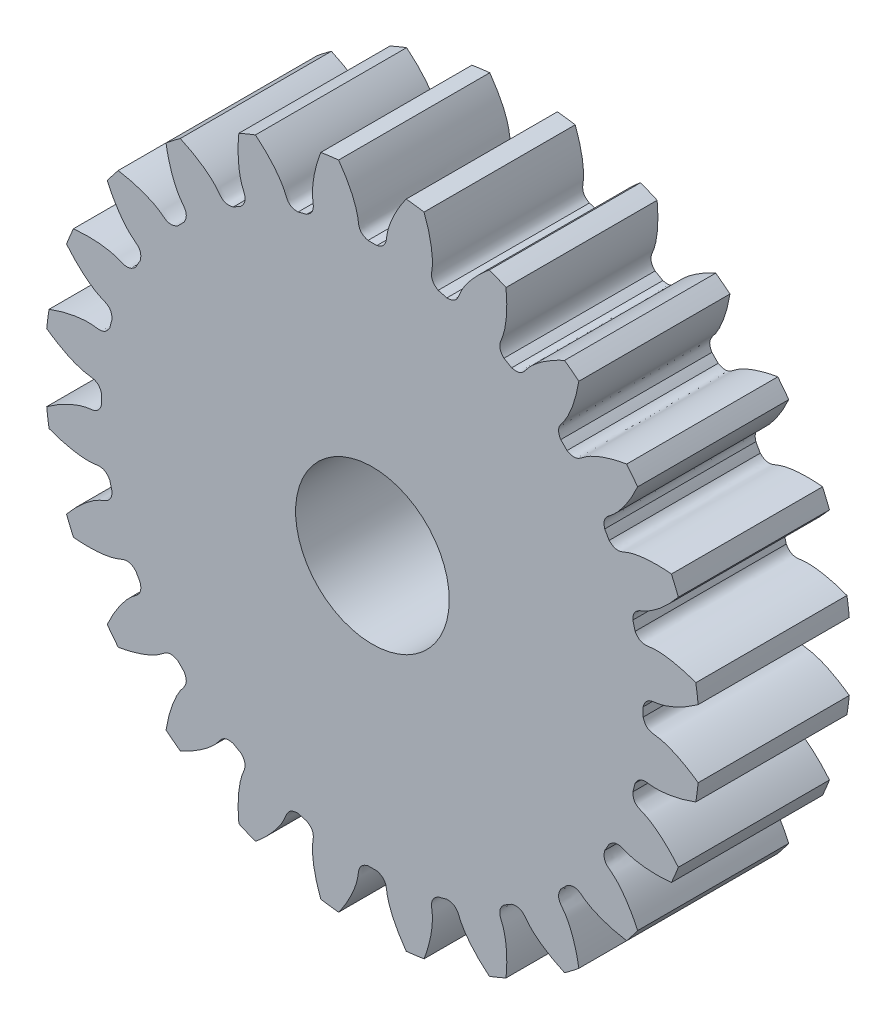
from build123d import *

# Parameters (mm, degrees)
SKETCH_1_R               = 6.5
EXTRUDE_1_DEPTH          = 3
CUT_EXTRUDE_1_DEPTH      = 10.669539803
PATTERN_CIRCULAR_1_COUNT = 24
CUT_EXTRUDE_2_REACH      = 11.623
SKETCH_4_R               = 1.525


with BuildPart() as part:
    # 草图1 → 凸台-拉伸1 (new body)
    with BuildSketch(Plane.XY):
        Circle(SKETCH_1_R)
    extrude(amount=EXTRUDE_1_DEPTH)

    # 草图2 → 切除-拉伸1 (cut, through all)
    with BuildSketch(Plane.XY):
        with BuildLine():
            ThreePointArc((0.088415956, 5.374272753), (0, 5.375), (-0.088415956, 5.374272753))
            add(Edge.make_bspline(
                [(-0.088415956, 5.374272753), (-0.283956108, 5.428430036), (-0.269523883, 5.557861799), (-0.293138588, 5.686342226), (-0.296517959, 5.702916521), (-0.300724242, 5.721620073), (-0.305840304, 5.742426358), (-0.311952817, 5.765305336), (-0.319146149, 5.790224685), (-0.327504211, 5.817149434), (-0.337109789, 5.846042111), (-0.348044663, 5.876862729), (-0.360389484, 5.909568827), (-0.374223721, 5.944115495), (-0.389625595, 5.980455405), (-0.406672011, 6.018538843), (-0.425438499, 6.058313744), (-0.445999145, 6.099725726), (-0.468426535, 6.142718129), (-0.492791687, 6.187232054), (-0.519163995, 6.233206399), (-0.547611171, 6.280577906), (-0.57819918, 6.329281201), (-0.610992189, 6.379248841), (-0.64605251, 6.430411359), (-0.68344054, 6.482697309), (-0.723214712, 6.53603332), (-0.765431443, 6.590344144), (-0.810145078, 6.645552705), (-0.857407842, 6.701580158), (-0.907269792, 6.758345935), (-0.959778768, 6.81576781), (-1.014980347, 6.873761948), (-1.0729178, 6.932242967), (-1.133632047, 6.991123994), (-1.197161611, 7.05031673), (-1.263542589, 7.109731505), (-1.332808587, 7.169277345), (-1.430211047, 7.249680778), (-1.505961903, 7.308439159), (-1.55780976, 7.347058965)],
                knots=[0, 0, 0, 0, 0.143961355, 0.149818462, 0.156576662, 0.164235955, 0.172796342, 0.182257821, 0.192620395, 0.203884061, 0.216048821, 0.229114674, 0.24308162, 0.25794966, 0.273718793, 0.290389019, 0.307960339, 0.326432751, 0.345806258, 0.366080857, 0.38725655, 0.409333336, 0.432311215, 0.456190188, 0.480970254, 0.506651413, 0.533233666, 0.560717012, 0.589101451, 0.618386984, 0.64857361, 0.679661329, 0.711650141, 0.744540047, 0.778331046, 0.813023138, 0.848616324, 0.885110603, 0.922505975, 1, 1, 1, 1], degree=3))
            ThreePointArc((-1.55780976, 7.347058965), (0, 7.510395907), (1.55780976, 7.347058965))
            add(Edge.make_bspline(
                [(0.088415956, 5.374272753), (0.283956108, 5.428430036), (0.269523883, 5.557861799), (0.293138588, 5.686342226), (0.296517959, 5.702916521), (0.300724242, 5.721620073), (0.305840304, 5.742426358), (0.311952817, 5.765305336), (0.319146149, 5.790224685), (0.327504211, 5.817149434), (0.337109789, 5.846042111), (0.348044663, 5.876862729), (0.360389484, 5.909568827), (0.374223721, 5.944115495), (0.389625595, 5.980455405), (0.406672011, 6.018538843), (0.425438499, 6.058313744), (0.445999145, 6.099725726), (0.468426535, 6.142718129), (0.492791687, 6.187232054), (0.519163995, 6.233206399), (0.547611171, 6.280577906), (0.57819918, 6.329281201), (0.610992189, 6.379248841), (0.64605251, 6.430411359), (0.68344054, 6.482697309), (0.723214712, 6.53603332), (0.765431443, 6.590344144), (0.810145078, 6.645552705), (0.857407842, 6.701580158), (0.907269792, 6.758345935), (0.959778768, 6.81576781), (1.014980347, 6.873761948), (1.0729178, 6.932242967), (1.133632047, 6.991123994), (1.197161611, 7.05031673), (1.263542589, 7.109731505), (1.332808587, 7.169277345), (1.430211047, 7.249680778), (1.505961903, 7.308439159), (1.55780976, 7.347058965)],
                knots=[0, 0, 0, 0, 0.143961355, 0.149818462, 0.156576662, 0.164235955, 0.172796342, 0.182257821, 0.192620395, 0.203884061, 0.216048821, 0.229114674, 0.24308162, 0.25794966, 0.273718793, 0.290389019, 0.307960339, 0.326432751, 0.345806258, 0.366080857, 0.38725655, 0.409333336, 0.432311215, 0.456190188, 0.480970254, 0.506651413, 0.533233666, 0.560717012, 0.589101451, 0.618386984, 0.64857361, 0.679661329, 0.711650141, 0.744540047, 0.778331046, 0.813023138, 0.848616324, 0.885110603, 0.922505975, 1, 1, 1, 1], degree=3))
        make_face()
    cut_extrude_1 = extrude(amount=CUT_EXTRUDE_1_DEPTH, mode=Mode.SUBTRACT)

    # 阵列(圆周)1: 切除-拉伸1 ×24 about axis
    pattern_circular_1_axis = Axis((0, 0, 3), (0, 0, -1))
    for i in range(1, PATTERN_CIRCULAR_1_COUNT):
        add(cut_extrude_1.rotate(pattern_circular_1_axis, i * 360 / PATTERN_CIRCULAR_1_COUNT), mode=Mode.SUBTRACT)

    # 草图4 → 切除-拉伸2 (cut, up to next)
    with BuildSketch(Plane.XY.offset(3), mode=Mode.PRIVATE) as cut_extrude_2_sk1:
        Circle(SKETCH_4_R)
    cut_extrude_2_tool1 = extrude(cut_extrude_2_sk1.sketch, amount=-CUT_EXTRUDE_2_REACH, mode=Mode.PRIVATE) & part.part
    add(cut_extrude_2_tool1.solids().sort_by_distance((0, 0, 3))[0], mode=Mode.SUBTRACT)


solid = part.part
